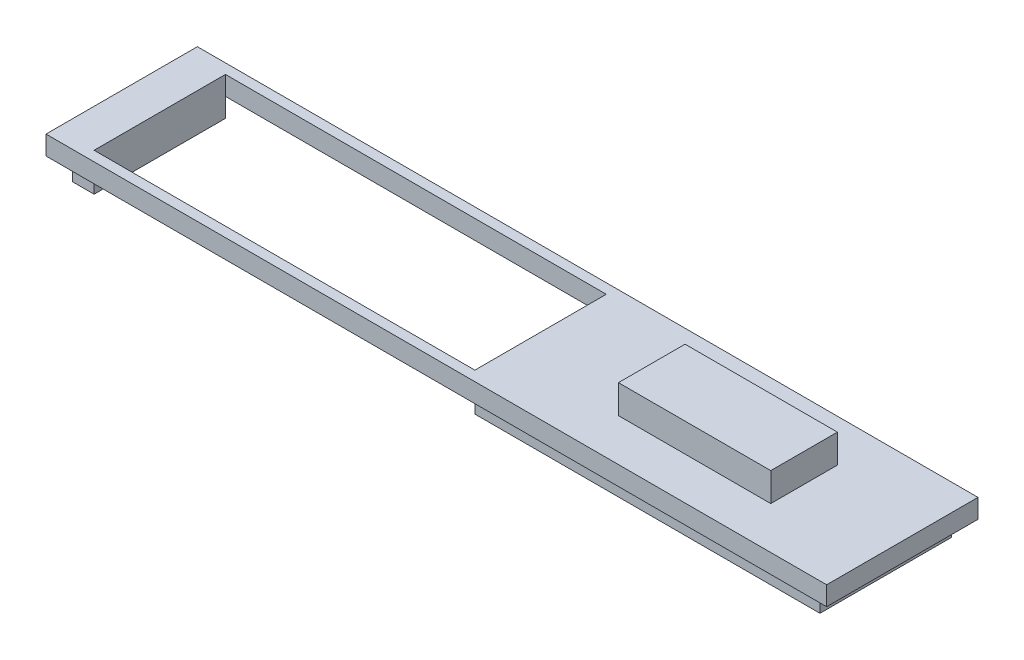
from build123d import *

# Parameters (mm, degrees)
SKETCH1_W           = 99.695
SKETCH1_H           = 17.526
BOSS_EXTRUDE1_DEPTH = 2.54
SKETCH2_W           = 104.14
SKETCH2_H           = 20.193
BOSS_EXTRUDE2_DEPTH = 2.54
SKETCH4_W           = 20.32
SKETCH4_H           = 8.89
BOSS_EXTRUDE3_DEPTH = 3.81
SKETCH5_W           = 50.8
SKETCH5_H           = 17.526
CUT_EXTRUDE1_DEPTH  = 54.282554483


with BuildPart() as part:
    # Sketch1 → Boss-Extrude1 (new body)
    with BuildSketch(Plane(origin=(0, 0, 0), x_dir=(1, 0, 0), z_dir=(0, 1, 0))):
        Rectangle(SKETCH1_W, SKETCH1_H)
    extrude(amount=BOSS_EXTRUDE1_DEPTH)

    # Sketch2 → Boss-Extrude2 (add)
    with BuildSketch(Plane(origin=(0, 2.54, 0), x_dir=(1, 0, 0), z_dir=(0, 1, 0))):
        Rectangle(SKETCH2_W, SKETCH2_H)
    extrude(amount=BOSS_EXTRUDE2_DEPTH)

    # Sketch4 → Boss-Extrude3 (add)
    with BuildSketch(Plane(origin=(0, 5.08, 0), x_dir=(1, 0, 0), z_dir=(0, 1, 0))):
        with Locations((28.80358553, 0)):
            Rectangle(SKETCH4_W, SKETCH4_H)
    extrude(amount=BOSS_EXTRUDE3_DEPTH)

    # Sketch5 → Cut-Extrude1 (cut, through all)
    with BuildSketch(Plane(origin=(0, 5.08, 0), x_dir=(1, 0, 0), z_dir=(0, 1, 0))):
        with Locations((-21.59, 0)):
            Rectangle(SKETCH5_W, SKETCH5_H)
    extrude(amount=-CUT_EXTRUDE1_DEPTH, mode=Mode.SUBTRACT)


solid = part.part
